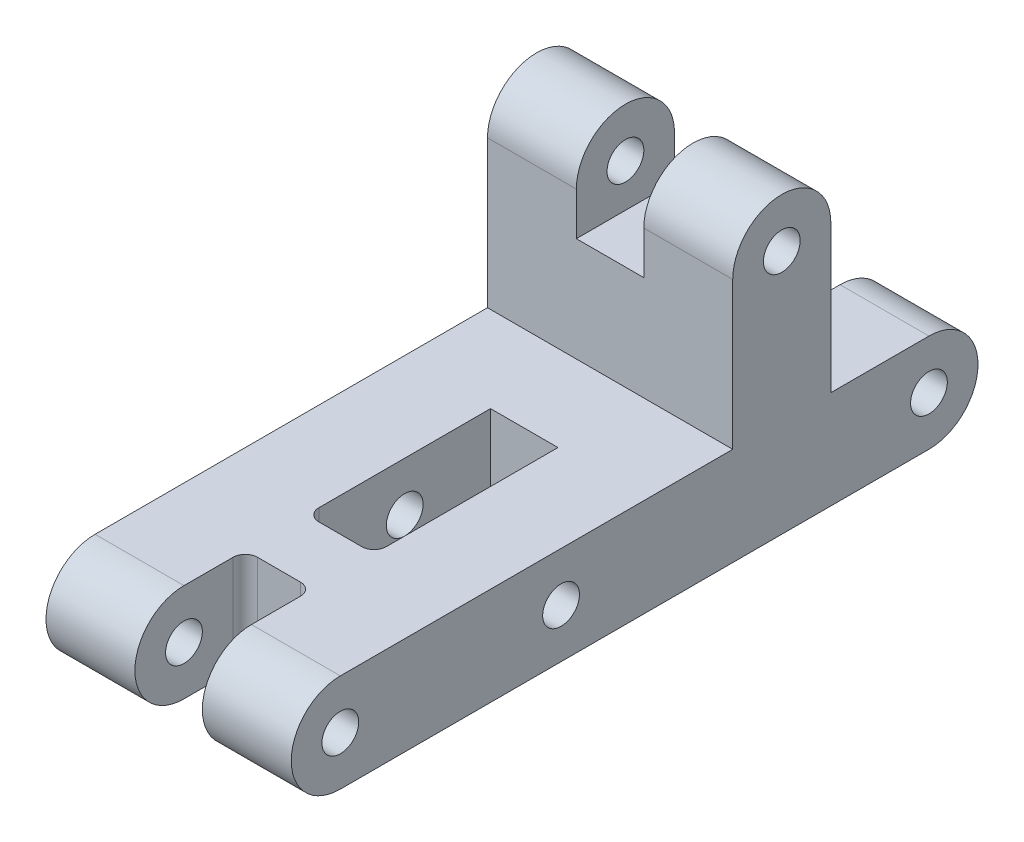
from build123d import *

# Parameters (mm, degrees)
CROQUIS1_R              = 1.5
SALIENTE_EXTRUIR1_DEPTH = 10
CROQUIS2_W              = 8
CROQUIS2_H              = 7.5
CROQUIS2_W_2            = 15
CROQUIS2_H_2            = 8
CROQUIS2_W_3            = 9
CORTAR_EXTRUIR1_DEPTH   = 2.75
REDONDEO1_R             = 1


with BuildPart() as part:
    # Croquis1 → Saliente-Extruir1 (new, symmetric)
    with BuildSketch(Plane(origin=(0, 0, 0), x_dir=(0, 0, -1), z_dir=(1, 0, 0))):
        with BuildLine():
            Line((-15, 4), (-1, 4))
            Line((-1, 4), (-1, 16))
            ThreePointArc((-1, 16), (3, 20), (7, 16))
            Line((7, 16), (7, 4))
            Line((7, 4), (15, 4))
            ThreePointArc((15, 4), (19, 0), (15, -4))
            Line((15, -4), (-15, -4))
            Line((-15, -4), (-33, -4))
            ThreePointArc((-33, -4), (-37, 0), (-33, 4))
            Line((-33, 4), (-15, 4))
        make_face()
        with Locations((15, 0)):
            Circle(CROQUIS1_R, mode=Mode.SUBTRACT)
        with Locations((3, 16)):
            Circle(CROQUIS1_R, mode=Mode.SUBTRACT)
        with Locations((-15, 0)):
            Circle(CROQUIS1_R, mode=Mode.SUBTRACT)
        with Locations((-33, 0)):
            Circle(CROQUIS1_R, mode=Mode.SUBTRACT)
    extrude(amount=SALIENTE_EXTRUIR1_DEPTH, both=True)

    # Croquis2 → Cortar-Extruir1 (cut, symmetric)
    with BuildSketch(Plane(origin=(0, 0, 0), x_dir=(0, 0, -1), z_dir=(1, 0, 0))):
        with Locations((3, 16.25)):
            Rectangle(CROQUIS2_W, CROQUIS2_H)
        with Locations((-15.5, 0)):
            Rectangle(CROQUIS2_W_2, CROQUIS2_H_2)
        with Locations((14.5, 0)):
            Rectangle(CROQUIS2_W_3, CROQUIS2_H_2)
        with Locations((-32.5, 0)):
            Rectangle(CROQUIS2_W_3, CROQUIS2_H_2)
    extrude(amount=CORTAR_EXTRUIR1_DEPTH, both=True, mode=Mode.SUBTRACT)

    # Redondeo1
    redondeo1_edges = [part.edges().sort_by_distance(p)[0] for p in [
        (2.75, 0, -10),
        (-2.75, 0, -10),
        (-2.75, 0, 23),
        (2.75, 0, 23),
        (2.75, 0, 28),
        (-2.75, 0, 28),
    ]]
    fillet(redondeo1_edges, radius=REDONDEO1_R)


solid = part.part
